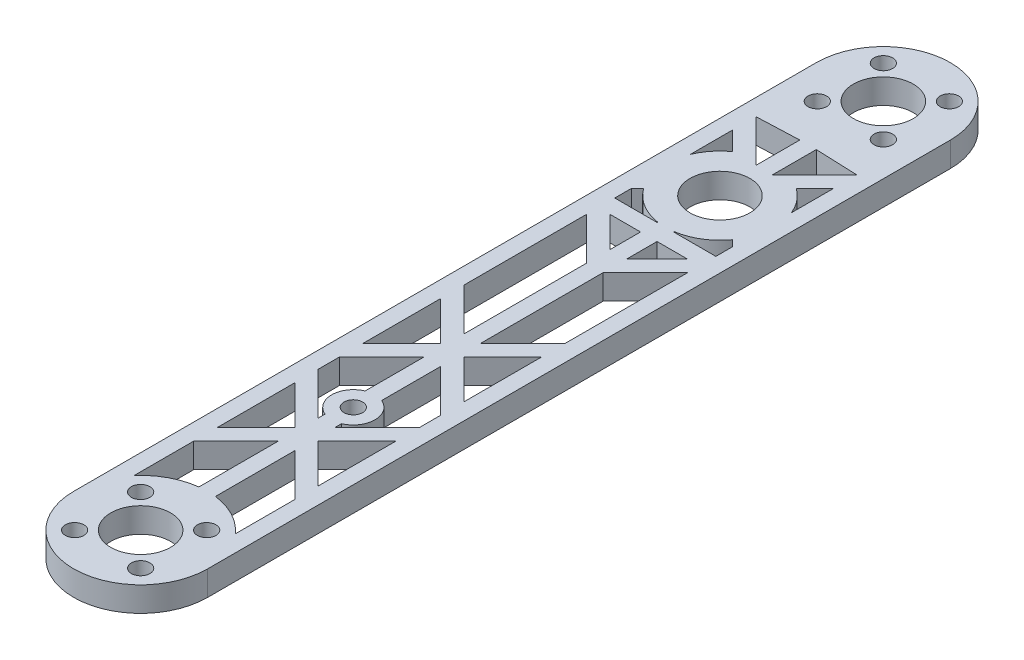
from build123d import *

# Parameters (mm, degrees)
SKETCH2_R           = 7.25
SKETCH2_R_2         = 2.25
BOSS_EXTRUDE1_DEPTH = 6
CUT_EXTRUDE1_START  = -6
CUT_EXTRUDE1_DEPTH  = 6


with BuildPart() as part:
    # Sketch2 → Boss-Extrude1 (new body)
    with BuildSketch(Plane(origin=(0, 0, 0), x_dir=(1, 0, 0), z_dir=(0, 1, 0))):
        with BuildLine():
            Line((-16.25, 90), (-16.25, -90))
            ThreePointArc((-16.25, -90), (0, -106.25), (16.25, -90))
            Line((16.25, -90), (16.25, 90))
            ThreePointArc((16.25, 90), (0, 106.25), (-16.25, 90))
        make_face()
        with Locations(Location((0, 90, 0), (0, 0, 270))):
            Circle(SKETCH2_R, mode=Mode.SUBTRACT)
        with Locations(Location((0, -90, 0), (0, 0, 270))):
            Circle(SKETCH2_R, mode=Mode.SUBTRACT)
        with Locations(Location((8, 98, 0), (0, 0, 270))):
            Circle(SKETCH2_R_2, mode=Mode.SUBTRACT)
        with Locations(Location((-8, 98, 0), (0, 0, 270))):
            Circle(SKETCH2_R_2, mode=Mode.SUBTRACT)
        with Locations(Location((-8, 82, 0), (0, 0, 270))):
            Circle(SKETCH2_R_2, mode=Mode.SUBTRACT)
        with Locations(Location((8, 82, 0), (0, 0, 270))):
            Circle(SKETCH2_R_2, mode=Mode.SUBTRACT)
        with Locations(Location((8, -98, 0), (0, 0, 90))):
            Circle(SKETCH2_R_2, mode=Mode.SUBTRACT)
        with Locations(Location((8, -82, 0), (0, 0, 90))):
            Circle(SKETCH2_R_2, mode=Mode.SUBTRACT)
        with Locations(Location((-8, -82, 0), (0, 0, 90))):
            Circle(SKETCH2_R_2, mode=Mode.SUBTRACT)
        with Locations(Location((-8, -98, 0), (0, 0, 90))):
            Circle(SKETCH2_R_2, mode=Mode.SUBTRACT)
        with Locations(Location((0, 50.402785483, 0), (0, 0, 270))):
            Circle(SKETCH2_R, mode=Mode.SUBTRACT)
        with Locations(Location((0, -38.452553576, 0), (0, 0, 270))):
            Circle(SKETCH2_R_2, mode=Mode.SUBTRACT)
    extrude(amount=BOSS_EXTRUDE1_DEPTH)

    # Sketch3 → Cut-Extrude1 (cut)
    with BuildSketch(Plane(origin=(0, 6, 0), x_dir=(1, 0, 0), z_dir=(0, 1, 0)).offset(CUT_EXTRUDE1_START)):
        Polygon((-12.25, 30.324358358), (-2, 20.074358358), (-2, -9.624126451), (-12.25, 0.625873549), align=None)
        Polygon((-12.25, -5.030980701), (-12.25, -23.874126451), (-2.828427125, -14.452553576), align=None)
        Polygon((-9.421572875, 33.152785483), (-2, 33.152785483), (-2, 25.731212608), align=None)
        Polygon((12.25, -23.874126451), (2.828427125, -14.452553576), (12.25, -5.030980701), align=None)
        Polygon((9.421572875, 33.152785483), (2, 33.152785483), (2, 25.731212608), align=None)
        Polygon((2, -9.624126451), (12.25, 0.625873549), (12.25, 30.324358358), (2, 20.074358358), align=None)
        Polygon((-12.25, 71.336551667), (-2, 61.086551667), (-2, 71.75), align=None)
        with BuildLine():
            Line((-12.25, 65.679697418), (-12.25, 55.452537952))
            ThreePointArc((-12.25, 55.452537952), (-10.391208444, 58.623812614), (-7.732662193, 61.162359611))
            Line((-7.732662193, 61.162359611), (-12.25, 65.679697418))
        make_face()
        with BuildLine():
            Line((-12.25, 41.179697418), (-12.25, 37.152785483))
            Line((-12.25, 37.152785483), (-2, 37.152785483))
            Line((-2, 37.152785483), (-2, 37.304598586))
            ThreePointArc((-2, 37.304598586), (-6.92090289, 39.103953544), (-10.759574128, 42.67012329))
            Line((-10.759574128, 42.67012329), (-12.25, 41.179697418))
        make_face()
        with BuildLine():
            Line((12.25, 41.179697418), (12.25, 37.152785483))
            Line((12.25, 37.152785483), (2, 37.152785483))
            Line((2, 37.152785483), (2, 37.304598586))
            ThreePointArc((2, 37.304598586), (6.92090289, 39.103953544), (10.759574128, 42.67012329))
            Line((10.759574128, 42.67012329), (12.25, 41.179697418))
        make_face()
        with BuildLine():
            Line((12.25, 65.679697418), (7.732662193, 61.162359611))
            ThreePointArc((7.732662193, 61.162359611), (10.391208444, 58.623812614), (12.25, 55.452537952))
            Line((12.25, 55.452537952), (12.25, 65.679697418))
        make_face()
        Polygon((2, 61.086551667), (2, 71.75), (12.25, 71.336551667), align=None)
        with BuildLine():
            Line((-2, -19.280980701), (-12.25, -29.530980701))
            Line((-12.25, -29.530980701), (-12.25, -34.729465511))
            Line((-12.25, -34.729465511), (-2, -44.979465511))
            Line((-2, -44.979465511), (-2, -43.306675536))
            ThreePointArc((-2, -43.306675536), (-5.25, -38.452553576), (-2, -33.598431616))
            Line((-2, -33.598431616), (-2, -19.280980701))
        make_face()
        Polygon((-12.25, -40.38631976), (-12.25, -59.229465511), (-2.828427125, -49.807892635), align=None)
        with BuildLine():
            Line((-2, -54.63631976), (-12.25, -64.88631976))
            Line((-12.25, -64.88631976), (-12.25, -79.322921748))
            ThreePointArc((-12.25, -79.322921748), (-7.628207354, -75.651726495), (-2, -73.873546577))
            Line((-2, -73.873546577), (-2, -54.63631976))
        make_face()
        with BuildLine():
            Line((12.25, -64.88631976), (12.25, -79.322921748))
            ThreePointArc((12.25, -79.322921748), (7.628207354, -75.651726495), (2, -73.873546577))
            Line((2, -73.873546577), (2, -54.63631976))
            Line((2, -54.63631976), (12.25, -64.88631976))
        make_face()
        Polygon((12.25, -59.229465511), (2.828427125, -49.807892635), (12.25, -40.38631976), align=None)
        with BuildLine():
            Line((12.25, -34.729465511), (2, -44.979465511))
            Line((2, -44.979465511), (2, -43.306675536))
            ThreePointArc((2, -43.306675536), (5.25, -38.452553576), (2, -33.598431616))
            Line((2, -33.598431616), (2, -19.280980701))
            Line((2, -19.280980701), (12.25, -29.530980701))
            Line((12.25, -29.530980701), (12.25, -34.729465511))
        make_face()
    extrude(amount=CUT_EXTRUDE1_DEPTH, mode=Mode.SUBTRACT)


solid = part.part
